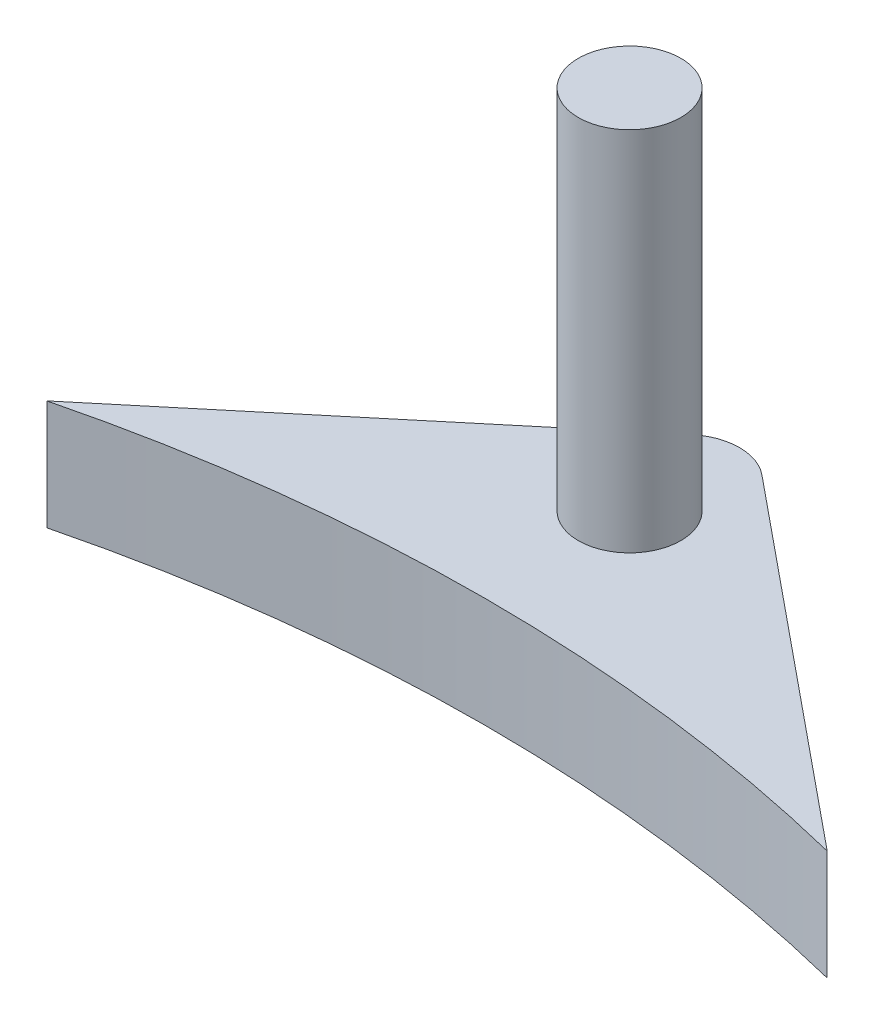
from build123d import *

# Parameters (mm, degrees)
BOSS_EXTRUDE1_DEPTH = 3
SKETCH2_R           = 1.4
BOSS_EXTRUDE2_DEPTH = 10


with BuildPart() as part:
    # Sketch1 → Boss-Extrude1 (new body)
    with BuildSketch(Plane(origin=(0, 0, 0), x_dir=(1, 0, 0), z_dir=(0, 1, 0))):
        with BuildLine():
            Line((-0.960614143, 1.152050549), (-10.554897615, -6.847949451))
            ThreePointArc((-10.554897615, -6.847949451), (0.08764455, -5.53477098), (10.731302024, -6.838878717))
            Line((10.731302024, -6.838878717), (0.94963012, 1.161121283))
            ThreePointArc((0.94963012, 1.161121283), (-0.007122622, 1.499983089), (-0.960614143, 1.152050549))
        make_face()
    extrude(amount=BOSS_EXTRUDE1_DEPTH)

    # Sketch2 → Boss-Extrude2 (add)
    with BuildSketch(Plane(origin=(0, 3, 0), x_dir=(1, 0, 0), z_dir=(0, 1, 0))):
        with Locations(Location((0, -1.5, 0), (0, 0, 270))):
            Circle(SKETCH2_R)
    extrude(amount=BOSS_EXTRUDE2_DEPTH)


solid = part.part
